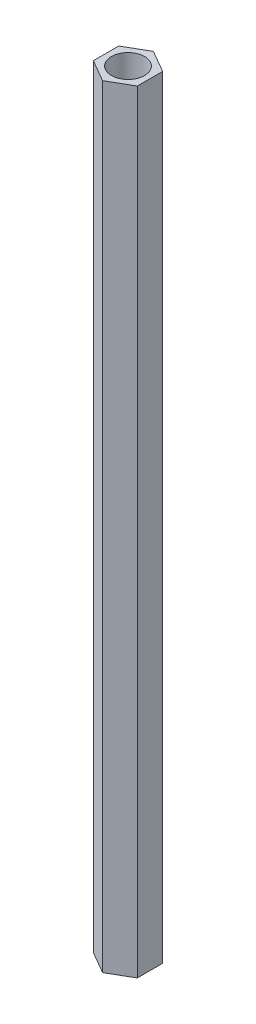
from build123d import *

# Parameters (mm, degrees)
SKETCH_1_R      = 1.5
EXTRUDE_1_DEPTH = 70


with BuildPart() as part:
    # 草图1 → 凸台-拉伸1 (new body)
    with BuildSketch(Plane(origin=(0, 0, 0), x_dir=(1, 0, 0), z_dir=(0, 1, 0))):
        Polygon((0, 2.3), (-1.991858429, 1.15), (-1.991858429, -1.15), (0, -2.3), (1.991858429, -1.15), (1.991858429, 1.15), align=None)
        with Locations(Location((0, 0, 0), (0, 0, 270))):
            Circle(SKETCH_1_R, mode=Mode.SUBTRACT)
    extrude(amount=EXTRUDE_1_DEPTH)


solid = part.part
